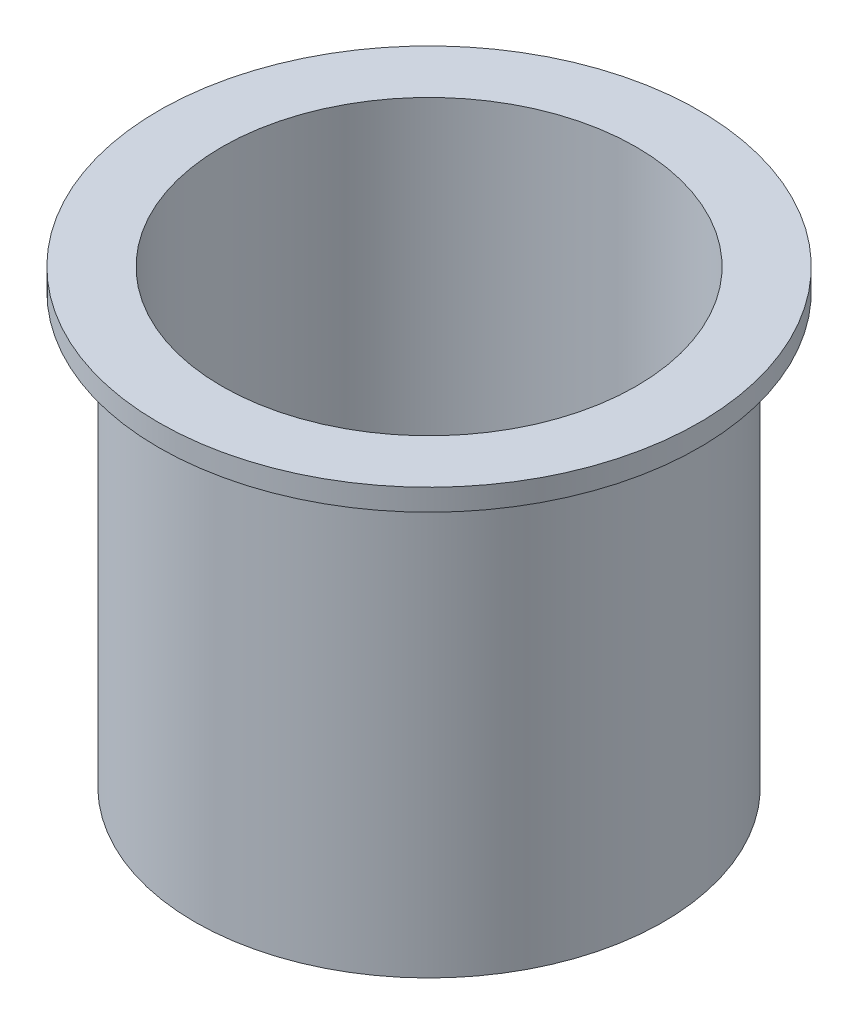
from build123d import *

# Parameters (mm, degrees)
POT_BASE_SKETCH_R   = 130
POT_BASE_DEPTH      = 15
POT_WALL_SKETCH_R   = 130
POT_WALL_SKETCH_R_2 = 115
POT_WALL_DEPTH      = 250
POT_START           = 238
POT_RIM_SKETCH_R    = 150
POT_RIM_SKETCH_R_2  = 115
POT_RIM_DEPTH       = 12


with BuildPart() as part:
    # Pot Base Sketch → Pot Base (new body)
    with BuildSketch(Plane(origin=(0, 0, 0), x_dir=(1, 0, 0), z_dir=(0, 1, 0))):
        with Locations(Location((0, 0, 0), (0, 0, 270))):
            Circle(POT_BASE_SKETCH_R)
    extrude(amount=POT_BASE_DEPTH)

    # Pot Wall Sketch → Pot Wall (add)
    with BuildSketch(Plane(origin=(0, 0, 0), x_dir=(1, 0, 0), z_dir=(0, 1, 0))):
        with Locations(Location((0, 0, 0), (0, 0, 270))):
            Circle(POT_WALL_SKETCH_R)
        with Locations(Location((0, 0, 0), (0, 0, 270))):
            Circle(POT_WALL_SKETCH_R_2, mode=Mode.SUBTRACT)
    extrude(amount=POT_WALL_DEPTH)

    # Pot Rim Sketch → Pot Rim (add)
    with BuildSketch(Plane(origin=(0, 0, 0), x_dir=(1, 0, 0), z_dir=(0, 1, 0)).offset(POT_START)):
        with Locations(Location((0, 0, 0), (0, 0, 270))):
            Circle(POT_RIM_SKETCH_R)
        with Locations(Location((0, 0, 0), (0, 0, 270))):
            Circle(POT_RIM_SKETCH_R_2, mode=Mode.SUBTRACT)
    extrude(amount=POT_RIM_DEPTH)


solid = part.part
